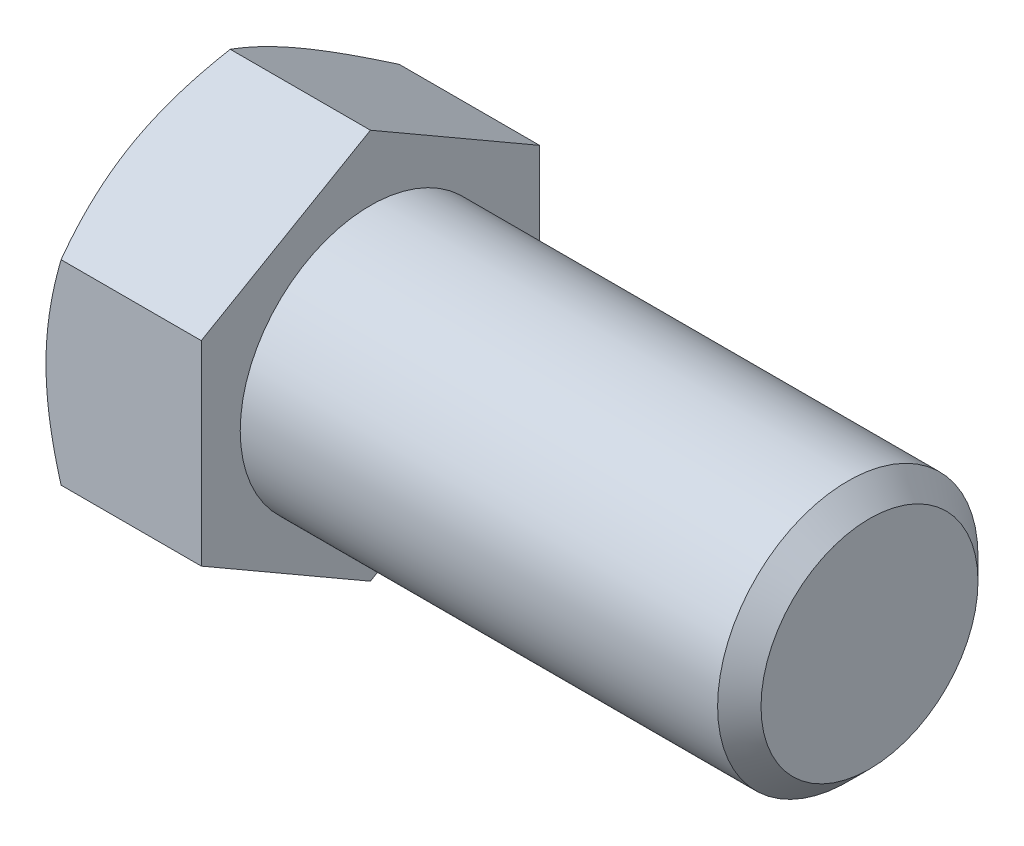
from build123d import *

# Parameters (mm, degrees)
SKETCH_2_OUTSIDE_W  = 27.946
SKETCH_2_OUTSIDE_H  = 27.946
CUT_EXTRUDE_1_DEPTH = 10
CHAMFER_1_SIZE      = 1


with BuildPart() as part:
    # Эскиз1 → Повернуть1 (revolve)
    with BuildSketch(Plane.XY, mode=Mode.PRIVATE) as revolve_1_sk:
        Polygon((0, 0), (23, 0), (23, 6), (0, 6), (0, 9), (-6.460769515, 9), (-7.5, 7.2), (-7.5, 0), align=None)
    revolve(revolve_1_sk.sketch.rotate(Axis((0, 0, 0), (1, 0, 0)), 90), axis=Axis((0, 0, 0), (1, 0, 0)))

    # Эскиз2 outside → Вырез-Вытянуть1 (cut)
    with BuildSketch(Plane(origin=(0, 0, 0), x_dir=(0, 0, -1), z_dir=(1, 0, 0))):
        Rectangle(SKETCH_2_OUTSIDE_W, SKETCH_2_OUTSIDE_H)
        Polygon((7.794228634, 4.5), (0, 9), (-7.794228634, 4.5), (-7.794228634, -4.5), (0, -9), (7.794228634, -4.5), align=None, mode=Mode.SUBTRACT)
    extrude(amount=-CUT_EXTRUDE_1_DEPTH, mode=Mode.SUBTRACT)

    # Фаска1
    chamfer_1_edges = [part.edges().sort_by_distance(p)[0] for p in [
        (23, 0, -6),
    ]]
    chamfer(chamfer_1_edges, length=CHAMFER_1_SIZE)


solid = part.part
